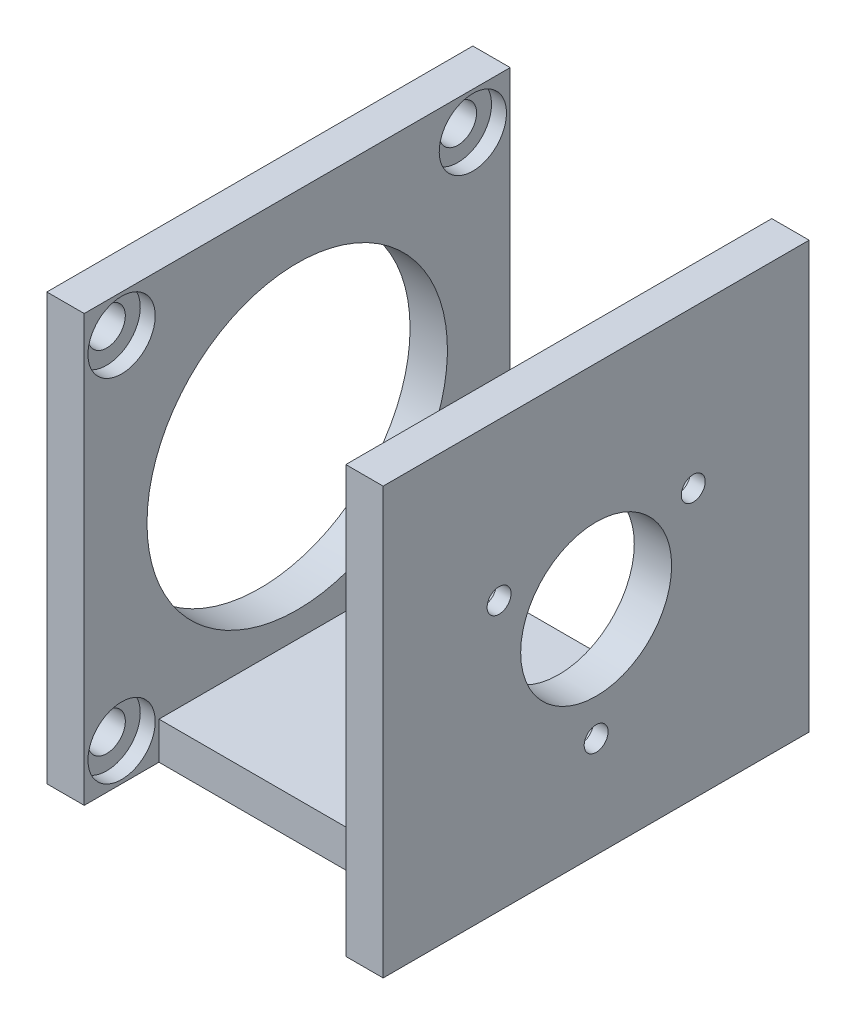
from build123d import *

# Parameters (mm, degrees)
EXTRUDE_1_DEPTH      = 57
SKETCH_2_W           = 35
SKETCH_2_H           = 10
CUT_EXTRUDE_1_DEPTH  = 90.319650693
CUT_EXTRUDE_2_REACH  = 94.32
SKETCH_3_R           = 20.1
SKETCH_4_R           = 4.5
CUT_EXTRUDE_6_DEPTH  = 2
CUT_EXTRUDE_7_REACH  = 94.32
SKETCH_5_R           = 2.5
CUT_EXTRUDE_8_REACH  = 94.32
SKETCH_9_R           = 10.1
CUT_EXTRUDE_9_REACH  = 94.32
SKETCH_1786_R        = 1.6
SKETCH_12_R          = 3.1
CUT_EXTRUDE_10_DEPTH = 3


with BuildPart() as part:
    # 草图1 → 凸台-拉伸1 (new body)
    with BuildSketch(Plane.XY):
        Polygon((0, 0), (0, 57), (5, 57), (5, 5), (40, 5), (40, 57), (45, 57), (45, 0), align=None)
    extrude(amount=EXTRUDE_1_DEPTH)

    # 草图2 → 切除-拉伸1 (cut, through all)
    with BuildSketch(Plane(origin=(0, 5, 0), x_dir=(1, 0, 0), z_dir=(0, 1, 0))):
        with Locations((22.5, -52)):
            Rectangle(SKETCH_2_W, SKETCH_2_H)
        with Locations((22.5, -5)):
            Rectangle(SKETCH_2_W, SKETCH_2_H)
    extrude(amount=-CUT_EXTRUDE_1_DEPTH, mode=Mode.SUBTRACT)

    # 草图3 → 切除-拉伸2 (cut, up to next)
    with BuildSketch(Plane.ZY, mode=Mode.PRIVATE) as cut_extrude_2_sk1:
        with Locations((28.5, 28.5)):
            Circle(SKETCH_3_R)
    cut_extrude_2_tool1 = extrude(cut_extrude_2_sk1.sketch, amount=-CUT_EXTRUDE_2_REACH, mode=Mode.PRIVATE) & part.part
    add(cut_extrude_2_tool1.solids().sort_by_distance((0, 28.5, 28.5))[0], mode=Mode.SUBTRACT)

    # 草图4 → 切除-拉伸6 (cut)
    with BuildSketch(Plane(origin=(5, 0, 0), x_dir=(0, 0, -1), z_dir=(1, 0, 0))):
        with Locations(Location((-52, 52, 0), (0, 0, 90))):
            Circle(SKETCH_4_R)
        with Locations(Location((-5, 52, 0), (0, 0, 90))):
            Circle(SKETCH_4_R)
        with Locations(Location((-5, 5, 0), (0, 0, 90))):
            Circle(SKETCH_4_R)
        with Locations(Location((-52, 5, 0), (0, 0, 90))):
            Circle(SKETCH_4_R)
    extrude(amount=-CUT_EXTRUDE_6_DEPTH, mode=Mode.SUBTRACT)

    # 草图5 → 切除-拉伸7 (cut, up to next)
    with BuildSketch(Plane(origin=(0, 0, 0), x_dir=(0, 0, -1), z_dir=(1, 0, 0)), mode=Mode.PRIVATE) as cut_extrude_7_sk1:
        with Locations(Location((-52, 52, 0), (0, 0, 90))):
            Circle(SKETCH_5_R)
    cut_extrude_7_tool1 = extrude(cut_extrude_7_sk1.sketch, amount=CUT_EXTRUDE_7_REACH, mode=Mode.PRIVATE) & part.part
    # 草图5 → 切除-拉伸7 (cut, up to next)
    with BuildSketch(Plane(origin=(0, 0, 0), x_dir=(0, 0, -1), z_dir=(1, 0, 0)), mode=Mode.PRIVATE) as cut_extrude_7_sk2:
        with Locations(Location((-5, 52, 0), (0, 0, 90))):
            Circle(SKETCH_5_R)
    cut_extrude_7_tool2 = extrude(cut_extrude_7_sk2.sketch, amount=CUT_EXTRUDE_7_REACH, mode=Mode.PRIVATE) & part.part
    # 草图5 → 切除-拉伸7 (cut, up to next)
    with BuildSketch(Plane(origin=(0, 0, 0), x_dir=(0, 0, -1), z_dir=(1, 0, 0)), mode=Mode.PRIVATE) as cut_extrude_7_sk3:
        with Locations(Location((-5, 5, 0), (0, 0, 90))):
            Circle(SKETCH_5_R)
    cut_extrude_7_tool3 = extrude(cut_extrude_7_sk3.sketch, amount=CUT_EXTRUDE_7_REACH, mode=Mode.PRIVATE) & part.part
    # 草图5 → 切除-拉伸7 (cut, up to next)
    with BuildSketch(Plane(origin=(0, 0, 0), x_dir=(0, 0, -1), z_dir=(1, 0, 0)), mode=Mode.PRIVATE) as cut_extrude_7_sk4:
        with Locations(Location((-52, 5, 0), (0, 0, 90))):
            Circle(SKETCH_5_R)
    cut_extrude_7_tool4 = extrude(cut_extrude_7_sk4.sketch, amount=CUT_EXTRUDE_7_REACH, mode=Mode.PRIVATE) & part.part
    add(cut_extrude_7_tool1.solids().sort_by_distance((0, 52, 52))[0], mode=Mode.SUBTRACT)
    add(cut_extrude_7_tool2.solids().sort_by_distance((0, 52, 5))[0], mode=Mode.SUBTRACT)
    add(cut_extrude_7_tool3.solids().sort_by_distance((0, 5, 5))[0], mode=Mode.SUBTRACT)
    add(cut_extrude_7_tool4.solids().sort_by_distance((0, 5, 52))[0], mode=Mode.SUBTRACT)

    # 草图9 → 切除-拉伸8 (cut, up to next)
    with BuildSketch(Plane(origin=(45, 0, 0), x_dir=(0, 0, -1), z_dir=(1, 0, 0)), mode=Mode.PRIVATE) as cut_extrude_8_sk1:
        with Locations(Location((-28.5, 28.5, 0), (0, 0, 90))):
            Circle(SKETCH_9_R)
    cut_extrude_8_tool1 = extrude(cut_extrude_8_sk1.sketch, amount=-CUT_EXTRUDE_8_REACH, mode=Mode.PRIVATE) & part.part
    add(cut_extrude_8_tool1.solids().sort_by_distance((45, 28.5, 28.5))[0], mode=Mode.SUBTRACT)

    # Sketch 1786 → 切除-拉伸9 (cut, up to next)
    with BuildSketch(Plane(origin=(45, 0, 0), x_dir=(0, 0, -1), z_dir=(1, 0, 0)), mode=Mode.PRIVATE) as cut_extrude_9_sk1:
        with Locations(Location((-28.5, 13.5, 0), (0, 0, 90))):
            Circle(SKETCH_1786_R)
    cut_extrude_9_tool1 = extrude(cut_extrude_9_sk1.sketch, amount=-CUT_EXTRUDE_9_REACH, mode=Mode.PRIVATE) & part.part
    # Sketch 1786 → 切除-拉伸9 (cut, up to next)
    with BuildSketch(Plane(origin=(45, 0, 0), x_dir=(0, 0, -1), z_dir=(1, 0, 0)), mode=Mode.PRIVATE) as cut_extrude_9_sk2:
        with Locations(Location((-41.490381057, 36, 0), (0, 0, 90))):
            Circle(SKETCH_1786_R)
    cut_extrude_9_tool2 = extrude(cut_extrude_9_sk2.sketch, amount=-CUT_EXTRUDE_9_REACH, mode=Mode.PRIVATE) & part.part
    # Sketch 1786 → 切除-拉伸9 (cut, up to next)
    with BuildSketch(Plane(origin=(45, 0, 0), x_dir=(0, 0, -1), z_dir=(1, 0, 0)), mode=Mode.PRIVATE) as cut_extrude_9_sk3:
        with Locations(Location((-15.509618943, 36, 0), (0, 0, 90))):
            Circle(SKETCH_1786_R)
    cut_extrude_9_tool3 = extrude(cut_extrude_9_sk3.sketch, amount=-CUT_EXTRUDE_9_REACH, mode=Mode.PRIVATE) & part.part
    add(cut_extrude_9_tool1.solids().sort_by_distance((45, 13.5, 28.5))[0], mode=Mode.SUBTRACT)
    add(cut_extrude_9_tool2.solids().sort_by_distance((45, 36, 41.490381))[0], mode=Mode.SUBTRACT)
    add(cut_extrude_9_tool3.solids().sort_by_distance((45, 36, 15.509619))[0], mode=Mode.SUBTRACT)

    # 草图12 → 切除-拉伸10 (cut)
    with BuildSketch(Plane.ZY.offset(-40)):
        with Locations((28.5, 13.5)):
            Circle(SKETCH_12_R)
        with Locations((15.509618943, 36)):
            Circle(SKETCH_12_R)
        with Locations((41.490381057, 36)):
            Circle(SKETCH_12_R)
    extrude(amount=-CUT_EXTRUDE_10_DEPTH, mode=Mode.SUBTRACT)


solid = part.part
